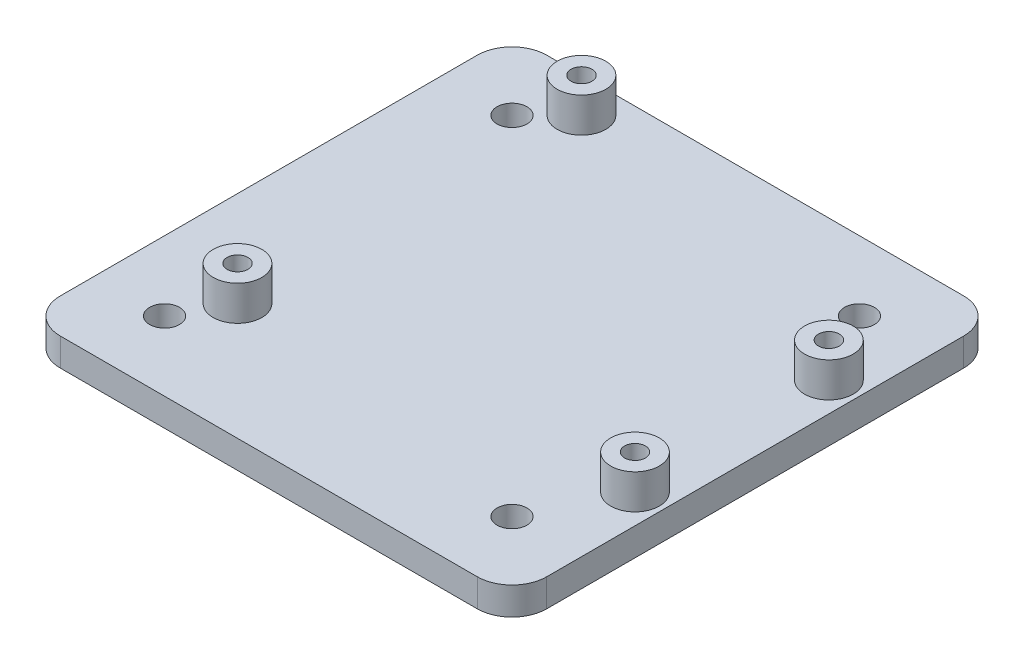
from build123d import *

# Parameters (mm, degrees)
SKETCH_2_W      = 70
SKETCH_2_H      = 70
SKETCH_2_R      = 2.15
EXTRUDE_1_DEPTH = 4
SKETCH_3_R      = 3.5
SKETCH_3_R_2    = 1.5
EXTRUDE_2_DEPTH = 5
FILLET_1_R      = 5


with BuildPart() as part:
    # 草圖2 → 填料-伸長1 (new body)
    with BuildSketch(Plane(origin=(0, 0, 0), x_dir=(1, 0, 0), z_dir=(0, 1, 0))):
        Rectangle(SKETCH_2_W, SKETCH_2_H)
        with Locations(Location((-25, 25, 0), (0, 0, 270))):
            Circle(SKETCH_2_R, mode=Mode.SUBTRACT)
        with Locations(Location((25, 25, 0), (0, 0, 270))):
            Circle(SKETCH_2_R, mode=Mode.SUBTRACT)
        with Locations(Location((-25, -25, 0), (0, 0, 270))):
            Circle(SKETCH_2_R, mode=Mode.SUBTRACT)
        with Locations(Location((25, -25, 0), (0, 0, 270))):
            Circle(SKETCH_2_R, mode=Mode.SUBTRACT)
    extrude(amount=EXTRUDE_1_DEPTH)

    # 草圖3 → 填料-伸長2 (add)
    # profile 1 of 4: a face of its own
    with BuildSketch(Plane(origin=(0, 4, 0), x_dir=(1, 0, 0), z_dir=(0, 1, 0))):
        with Locations(Location((-20, 30, 0), (0, 0, 270))):
            Circle(SKETCH_3_R)
        with Locations(Location((-20, 30, 0), (0, 0, 270))):
            Circle(SKETCH_3_R_2, mode=Mode.SUBTRACT)
    # profile 2 of 4: a face of its own
    with BuildSketch(Plane(origin=(0, 4, 0), x_dir=(1, 0, 0), z_dir=(0, 1, 0))):
        with Locations(Location((30.8, 14.8, 0), (0, 0, 270))):
            Circle(SKETCH_3_R)
        with Locations(Location((30.8, 14.8, 0), (0, 0, 270))):
            Circle(SKETCH_3_R_2, mode=Mode.SUBTRACT)
    # profile 3 of 4: a face of its own
    with BuildSketch(Plane(origin=(0, 4, 0), x_dir=(1, 0, 0), z_dir=(0, 1, 0))):
        with Locations(Location((30.8, -13.1, 0), (0, 0, 270))):
            Circle(SKETCH_3_R)
        with Locations(Location((30.8, -13.1, 0), (0, 0, 270))):
            Circle(SKETCH_3_R_2, mode=Mode.SUBTRACT)
    # profile 4 of 4: a face of its own
    with BuildSketch(Plane(origin=(0, 4, 0), x_dir=(1, 0, 0), z_dir=(0, 1, 0))):
        with Locations(Location((-21.3, -18.2, 0), (0, 0, 270))):
            Circle(SKETCH_3_R)
        with Locations(Location((-21.3, -18.2, 0), (0, 0, 270))):
            Circle(SKETCH_3_R_2, mode=Mode.SUBTRACT)
    extrude(amount=EXTRUDE_2_DEPTH)

    # 圓角1
    fillet_1_edges = [part.edges().sort_by_distance(p)[0] for p in [
        (35, 2, 35),
        (-35, 2, 35),
        (-35, 2, -35),
        (35, 2, -35),
    ]]
    fillet(fillet_1_edges, radius=FILLET_1_R)


solid = part.part
